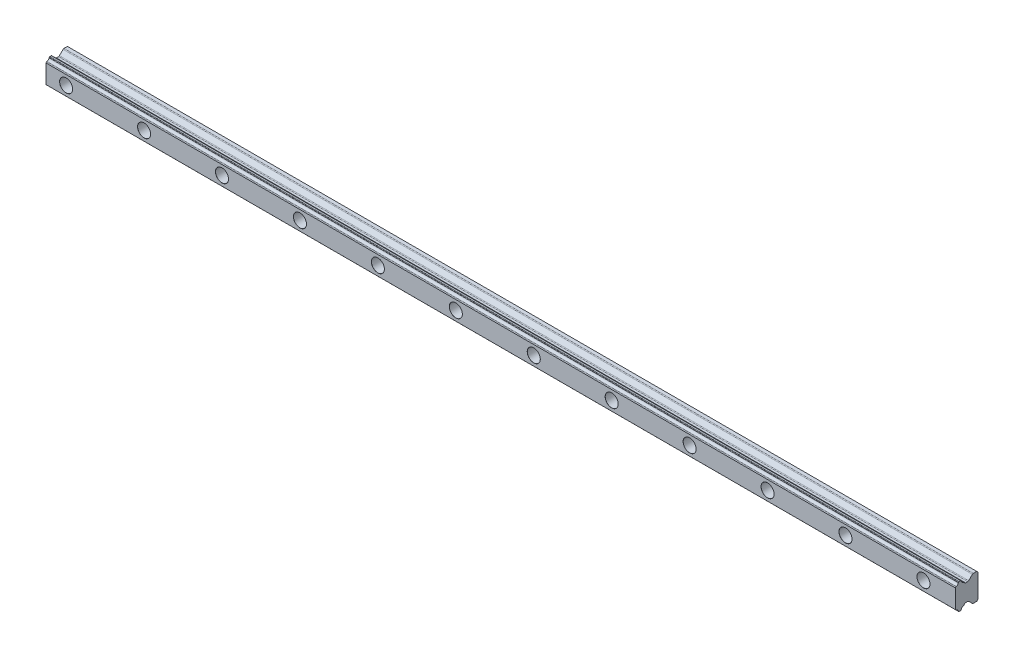
from build123d import *

# Parameters (mm, degrees)
HGR_HGR20_1_DEPTH = 700
LPATTERN1_COUNT   = 12
LPATTERN1_PITCH   = 60


with BuildPart() as part:
    # Sketch14 → Hgr HGR20(1) (new body)
    with BuildSketch(Plane(origin=(350, 0, 0), x_dir=(0, -1, 0), z_dir=(-1, 0, 0))):
        with BuildLine():
            Line((-9, 0), (9, 0))
            Line((9, 0), (10, 1))
            Line((10, 1), (10, 3.656507036))
            ThreePointArc((10, 3.656507036), (9.92387953, 4.039190479), (9.707106773, 4.363613837))
            Line((9.707106773, 4.363613837), (6.892893227, 7.177827383))
            ThreePointArc((6.892893227, 7.177827383), (6.67612047, 7.502250741), (6.6, 7.884934184))
            Line((6.6, 7.884934184), (6.6, 9.445065806))
            ThreePointArc((6.6, 9.445065806), (6.67612047, 9.827749249), (6.892893227, 10.152172607))
            Line((6.892893227, 10.152172607), (7.63016236, 10.88944174))
            ThreePointArc((7.63016236, 10.88944174), (7.773916168, 11.035785916), (7.84680643, 11.2275378))
            ThreePointArc((7.84680643, 11.2275378), (8.396388337, 12.262927707), (9.431778248, 12.812509604))
            ThreePointArc((9.431778248, 12.812509604), (9.57149389, 12.861817745), (9.690625667, 12.949905047))
            Line((9.690625667, 12.949905047), (9.85355341, 13.11283279))
            ThreePointArc((9.85355341, 13.11283279), (9.961939771, 13.275044443), (10, 13.466386134))
            Line((10, 13.466386134), (10, 14.523613846))
            ThreePointArc((10, 14.523613846), (9.961939771, 14.714955537), (9.85355341, 14.87716719))
            Line((9.85355341, 14.87716719), (9.678500884, 15.052219716))
            ThreePointArc((9.678500884, 15.052219716), (9.560417671, 15.13974885), (9.421985128, 15.189159636))
            ThreePointArc((9.421985128, 15.189159636), (8.395921997, 15.736919373), (7.84816225, 16.7629825))
            ThreePointArc((7.84816225, 16.7629825), (7.7751915, 16.95300083), (7.63253117, 17.09818942))
            Line((7.63253117, 17.09818942), (7.23072061, 17.49999998))
            Line((7.23072061, 17.49999998), (-7.23072061, 17.49999998))
            Line((-7.23072061, 17.49999998), (-7.63253117, 17.09818942))
            ThreePointArc((-7.63253117, 17.09818942), (-7.775191493, 16.953000826), (-7.84816225, 16.7629825))
            ThreePointArc((-7.84816225, 16.7629825), (-8.395921988, 15.736919382), (-9.421985103, 15.189159641))
            ThreePointArc((-9.421985103, 15.189159641), (-9.560417671, 15.139748844), (-9.678500907, 15.052219693))
            Line((-9.678500907, 15.052219693), (-9.85355341, 14.87716719))
            ThreePointArc((-9.85355341, 14.87716719), (-9.961939771, 14.714955537), (-10, 14.523613846))
            Line((-10, 14.523613846), (-10, 13.466386134))
            ThreePointArc((-10, 13.466386134), (-9.961939771, 13.275044443), (-9.85355341, 13.11283279))
            Line((-9.85355341, 13.11283279), (-9.690625709, 12.949905089))
            ThreePointArc((-9.690625709, 12.949905089), (-9.571493891, 12.861817755), (-9.431778202, 12.812509595))
            ThreePointArc((-9.431778202, 12.812509595), (-8.39638832, 12.26292769), (-7.84680643, 11.2275378))
            ThreePointArc((-7.84680643, 11.2275378), (-7.773916172, 11.035785914), (-7.63016236, 10.88944174))
            Line((-7.63016236, 10.88944174), (-6.892893227, 10.152172607))
            ThreePointArc((-6.892893227, 10.152172607), (-6.67612047, 9.827749249), (-6.6, 9.445065806))
            Line((-6.6, 9.445065806), (-6.6, 7.884934184))
            ThreePointArc((-6.6, 7.884934184), (-6.67612047, 7.502250741), (-6.892893227, 7.177827383))
            Line((-6.892893227, 7.177827383), (-9.707106773, 4.363613837))
            ThreePointArc((-9.707106773, 4.363613837), (-9.92387953, 4.039190479), (-10, 3.656507036))
            Line((-10, 3.656507036), (-10, 1))
            Line((-10, 1), (-9, 0))
        make_face()
    extrude(amount=HGR_HGR20_1_DEPTH)

    # Sketch16 → CBORE for M5 Hex Socket Head Cap Screw1 (revolve, cut)
    with BuildSketch(Plane(origin=(-334.5, 0, 17.49999998), x_dir=(0, -1, 0), z_dir=(1, 0, 0))):
        Polygon((0, 0), (0, 17.49999998), (2.9, 17.49999998), (2.9, 8.5), (5, 8.5), (5, 0.025), (5.025, 0), align=None)
    cbore_for_m5_hex_socket_head_cap_screw1 = revolve(axis=Axis((-334.5, 0, 23.84999998), (0, 0, -1)), mode=Mode.SUBTRACT)

    # LPattern1: CBORE for M5 Hex Socket Head Cap Screw1 ×12
    with Locations(*[(i * LPATTERN1_PITCH, 0, 0) for i in range(1, LPATTERN1_COUNT)]):
        add(cbore_for_m5_hex_socket_head_cap_screw1, mode=Mode.SUBTRACT)


solid = part.part
